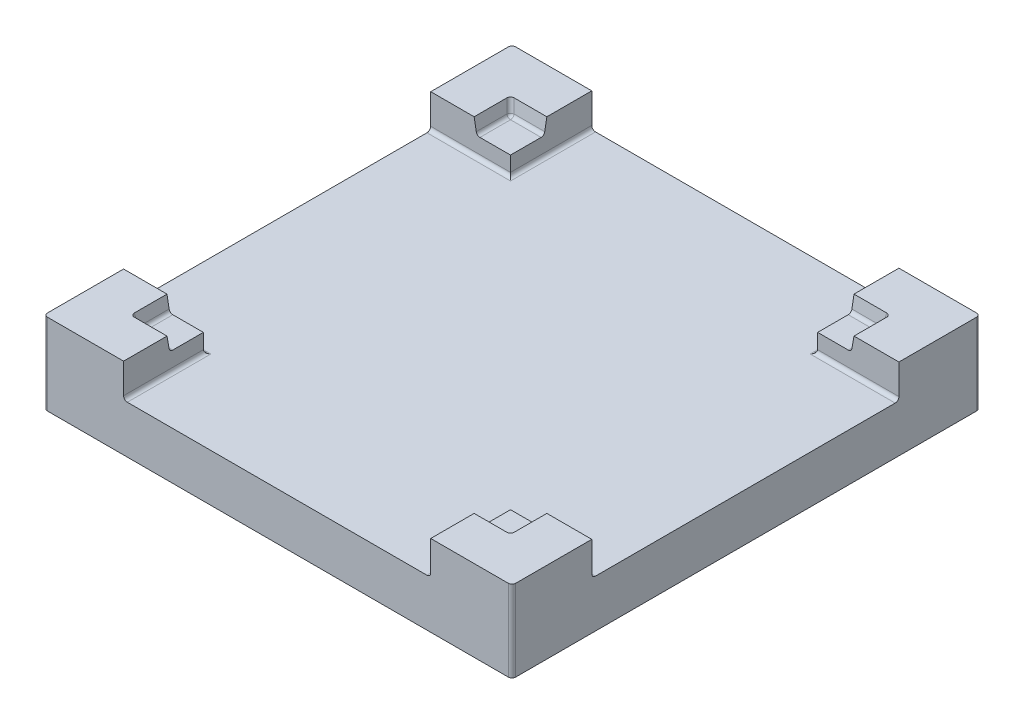
from build123d import *

# Parameters (mm, degrees)
SKETCH1_W           = 125
SKETCH1_H           = 125
BOSS_EXTRUDE1_DEPTH = 21.7
SKETCH2_W           = 100
SKETCH2_H           = 100
CUT_EXTRUDE1_DEPTH  = 9
FILLET2_R           = 1
SKETCH4_W           = 82
SKETCH4_H           = 12.7
SKETCH4_W_2         = 12.3
SKETCH4_H_2         = 82
SKETCH4_H_3         = 12.3
SKETCH4_W_3         = 12.7
CUT_EXTRUDE2_DEPTH  = 9
SKETCH5_W           = 9
SKETCH5_H           = 9
BOSS_EXTRUDE2_DEPTH = 5
DRAFT1_ANGLE        = 10
DRAFT2_ANGLE        = 10
DRAFT3_ANGLE        = 10
DRAFT4_ANGLE        = 10
FILLET3_R           = 1


with BuildPart() as part:
    # Sketch1 → Boss-Extrude1 (new body)
    with BuildSketch(Plane(origin=(0, 0, 0), x_dir=(1, 0, 0), z_dir=(0, 1, 0))):
        with Locations((62.5, 62.5)):
            Rectangle(SKETCH1_W, SKETCH1_H)
    extrude(amount=BOSS_EXTRUDE1_DEPTH)

    # Sketch2 → Cut-Extrude1 (cut)
    with BuildSketch(Plane(origin=(0, 21.7, 0), x_dir=(1, 0, 0), z_dir=(0, 1, 0))):
        with Locations((62.3, 62.3)):
            Rectangle(SKETCH2_W, SKETCH2_H)
    extrude(amount=-CUT_EXTRUDE1_DEPTH, mode=Mode.SUBTRACT)

    # Fillet2
    fillet2_edges = [part.edges().sort_by_distance(p)[0] for p in [
        (0, 10.85, -125),
        (125, 10.85, -125),
        (125, 10.85, 0),
        (0, 10.85, 0),
    ]]
    fillet(fillet2_edges, radius=FILLET2_R)

    # Sketch4 → Cut-Extrude2 (cut)
    with BuildSketch(Plane(origin=(0, 21.7, 0), x_dir=(1, 0, 0), z_dir=(0, 1, 0))):
        with Locations((62.3, 118.65)):
            Rectangle(SKETCH4_W, SKETCH4_H)
        with Locations((6.15, 62.3)):
            Rectangle(SKETCH4_W_2, SKETCH4_H_2)
        with Locations((62.3, 6.15)):
            Rectangle(SKETCH4_W, SKETCH4_H_3)
        with Locations((118.65, 62.3)):
            Rectangle(SKETCH4_W_3, SKETCH4_H_2)
    extrude(amount=-CUT_EXTRUDE2_DEPTH, mode=Mode.SUBTRACT)

    # Sketch5 → Boss-Extrude2 (add)
    with BuildSketch(Plane(origin=(0, 12.7, 0), x_dir=(1, 0, 0), z_dir=(0, 1, 0))):
        with Locations((107.8, 16.8)):
            Rectangle(SKETCH5_W, SKETCH5_H)
        with Locations((16.8, 16.8)):
            Rectangle(SKETCH5_W, SKETCH5_H)
        with Locations((16.8, 107.8)):
            Rectangle(SKETCH5_W, SKETCH5_H)
        with Locations((107.8, 107.8)):
            Rectangle(SKETCH5_W, SKETCH5_H)
    extrude(amount=BOSS_EXTRUDE2_DEPTH)

    # Draft1
    draft1_faces = [part.faces().sort_by_distance(p)[0] for p in [
        (112.3, 19.7, -16.8),
        (107.8, 19.7, -12.3),
    ]]
    draft(draft1_faces, Plane.ZX.offset(17.7), DRAFT1_ANGLE)

    # Draft2
    draft2_faces = [part.faces().sort_by_distance(p)[0] for p in [
        (12.3, 19.7, -16.8),
        (16.8, 19.7, -12.3),
    ]]
    draft(draft2_faces, Plane.ZX.offset(17.7), DRAFT2_ANGLE)

    # Draft3
    draft3_faces = [part.faces().sort_by_distance(p)[0] for p in [
        (16.8, 19.7, -112.3),
        (12.3, 19.7, -107.8),
    ]]
    draft(draft3_faces, Plane.ZX.offset(17.7), DRAFT3_ANGLE)

    # Draft4
    draft4_faces = [part.faces().sort_by_distance(p)[0] for p in [
        (112.3, 19.7, -107.8),
        (107.8, 19.7, -112.3),
    ]]
    draft(draft4_faces, Plane.ZX.offset(17.7), DRAFT4_ANGLE)

    # Fillet3
    fillet3_edges = [part.edges().sort_by_distance(p)[0] for p in [
        (112.652653961, 19.7, -11.947346039),
        (112.3, 17.7, -16.8),
        (107.8, 17.7, -12.3),
        (11.947346039, 19.7, -11.947346039),
        (12.3, 17.7, -16.8),
        (16.8, 17.7, -12.3),
        (11.947346039, 19.7, -112.652653961),
        (12.3, 17.7, -107.8),
        (16.8, 17.7, -112.3),
        (112.652653961, 19.7, -112.652653961),
        (112.3, 17.7, -107.8),
        (107.8, 17.7, -112.3),
        (103.3, 12.7, -114.15),
        (21.3, 12.7, -114.15),
        (10.65, 12.7, -21.3),
        (10.65, 12.7, -103.3),
        (103.3, 12.7, -10.65),
        (21.3, 12.7, -10.65),
        (114.15, 12.7, -21.3),
        (114.15, 12.7, -103.3),
    ]]
    fillet(fillet3_edges, radius=FILLET3_R)


solid = part.part
